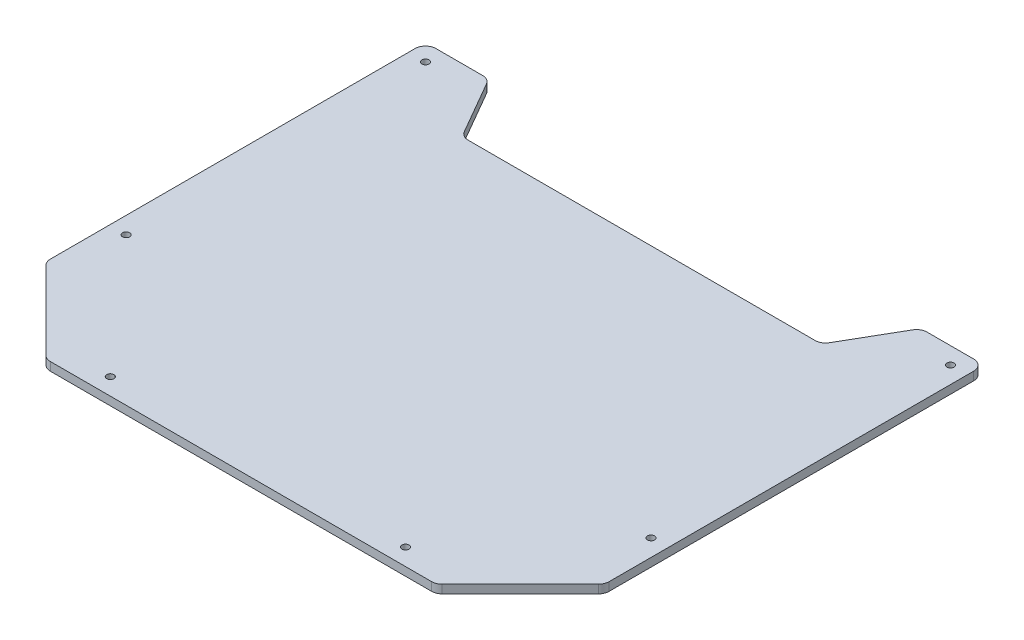
from build123d import *

# Parameters (mm, degrees)
BOSS_EXTRU_1_DEPTH      = 4
ESQUISSE2_R             = 1
ENL_V_MAT_EXTRU_1_DEPTH = 257.850637531
D_GAGEMENT_M31_D        = 3.4
D_GAGEMENT_M31_DEPTH    = 10
D_GAGEMENT_M31_TIP      = 1.021463052
CONG_1_R                = 5


with BuildPart() as part:
    # Esquisse1 → Boss.-Extru.1 (new body)
    with BuildSketch(Plane(origin=(0, 0, 0), x_dir=(1, 0, 0), z_dir=(0, 1, 0))):
        Polygon((-92.5, 0), (92.5, 0), (132.5, 40), (132.5, 220), (102.5, 220), (85.179491924, 190), (-85.179491924, 190), (-102.5, 220), (-132.5, 220), (-132.5, 40), align=None)
    extrude(amount=BOSS_EXTRU_1_DEPTH)

    # Esquisse2 → Enlèv. mat.-Extru.1 (cut, through all)
    with BuildSketch(Plane(origin=(0, 4, 0), x_dir=(1, 0, 0), z_dir=(0, 1, 0))):
        with Locations(Location((70, 8, 0), (0, 0, 270))):
            Circle(ESQUISSE2_R)
        with Locations(Location((124.5, 70, 0), (0, 0, 270))):
            Circle(ESQUISSE2_R)
        with Locations(Location((124.5, 212, 0), (0, 0, 270))):
            Circle(ESQUISSE2_R)
        with Locations(Location((-70, 8, 0), (0, 0, 90))):
            Circle(ESQUISSE2_R)
        with Locations(Location((-124.5, 70, 0), (0, 0, 90))):
            Circle(ESQUISSE2_R)
        with Locations(Location((-124.5, 212, 0), (0, 0, 90))):
            Circle(ESQUISSE2_R)
    extrude(amount=-ENL_V_MAT_EXTRU_1_DEPTH, mode=Mode.SUBTRACT)

    # Dégagement M31
    with Locations(Plane(origin=(0, 4, 0), x_dir=(1, 0, 0), z_dir=(0, 1, 0))):
        with Locations((-70, 8), (70, 8), (124.5, 70), (124.5, 212), (-124.5, 212), (-124.5, 70)):
            Hole(D_GAGEMENT_M31_D / 2, depth=D_GAGEMENT_M31_DEPTH)
            with Locations((0, 0, -(D_GAGEMENT_M31_DEPTH + D_GAGEMENT_M31_TIP / 2))):  # 118° drill point
                Cone(0, D_GAGEMENT_M31_D / 2, D_GAGEMENT_M31_TIP, mode=Mode.SUBTRACT)

    # Congé1
    cong_1_edges = [part.edges().sort_by_distance(p)[0] for p in [
        (132.5, 2, -220),
        (132.5, 2, -40),
        (92.5, 2, 0),
        (-92.5, 2, 0),
        (-132.5, 2, -40),
        (-132.5, 2, -220),
        (-102.5, 2, -220),
        (-85.179491924, 2, -190),
        (85.179491924, 2, -190),
        (102.5, 2, -220),
    ]]
    fillet(cong_1_edges, radius=CONG_1_R)


solid = part.part
